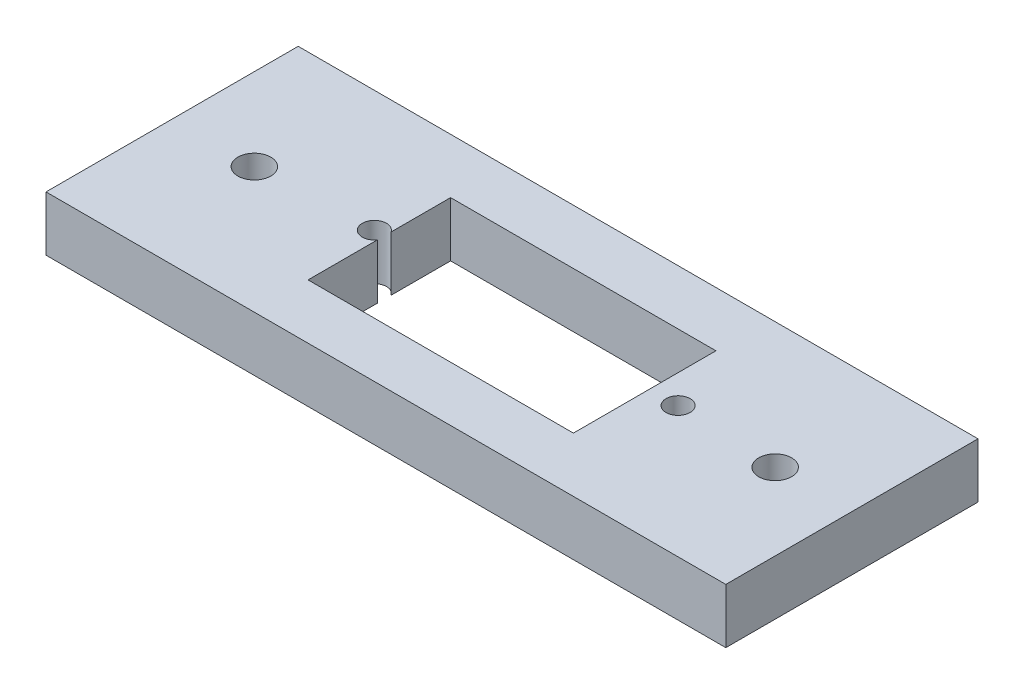
from build123d import *

# Parameters (mm, degrees)
SKETCH4_W           = 62
SKETCH4_H           = 23
SKETCH4_W_2         = 24.2
SKETCH4_H_2         = 13
BOSS_EXTRUDE2_DEPTH = 5
SKETCH7_R           = 1.1
SKETCH7_R_2         = 1.5
CUT_EXTRUDE3_DEPTH  = 10


with BuildPart() as part:
    # Sketch4 → Boss-Extrude2 (new body)
    with BuildSketch(Plane(origin=(0, 0, 0), x_dir=(1, 0, 0), z_dir=(0, 1, 0))):
        with Locations((31, 11.5)):
            Rectangle(SKETCH4_W, SKETCH4_H)
        with Locations((31, 11.5)):
            Rectangle(SKETCH4_W_2, SKETCH4_H_2, mode=Mode.SUBTRACT)
    extrude(amount=BOSS_EXTRUDE2_DEPTH)

    # Sketch7 → Cut-Extrude3 (cut)
    with BuildSketch(Plane(origin=(0, 5, 0), x_dir=(1, 0, 0), z_dir=(0, 1, 0))):
        with Locations(Location((45.7, 11.95, 0), (0, 0, 270))):
            Circle(SKETCH7_R)
        with Locations((18, 11.95)):
            Circle(SKETCH7_R)
        with Locations(Location((7.5, 11.5, 0), (0, 0, 270))):
            Circle(SKETCH7_R_2)
        with Locations(Location((55, 11.5, 0), (0, 0, 270))):
            Circle(SKETCH7_R_2)
    extrude(amount=-CUT_EXTRUDE3_DEPTH, mode=Mode.SUBTRACT)


solid = part.part
